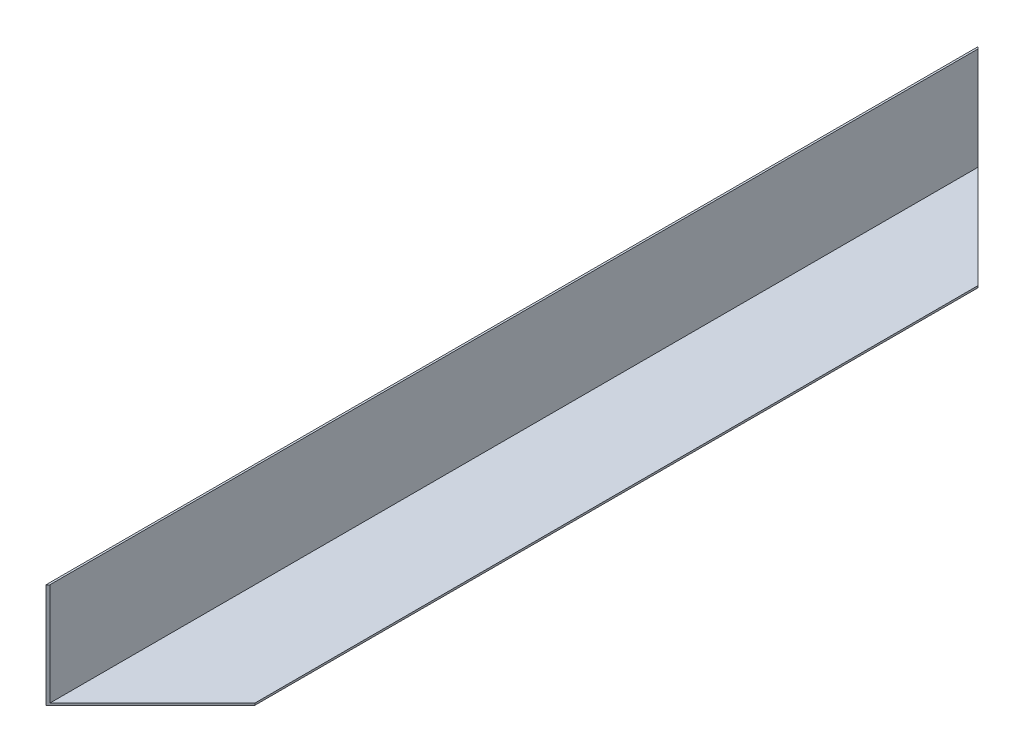
from build123d import *

# Parameters (mm, degrees)
BOSS_EXTRUDE1_DEPTH = 210


with BuildPart() as part:
    # Sketch1 → Boss-Extrude1 (new, symmetric)
    with BuildSketch(Plane.XY):
        Polygon((0, 45), (0, 0), (45, 0), (45, 0.833333333), (0.833333333, 0.833333333), (0.833333333, 45), align=None)
    extrude(amount=BOSS_EXTRUDE1_DEPTH, both=True)

    # SurfaceCut5
    split(bisect_by=Plane(origin=(100.416666667, 0, -100.416666667), x_dir=(0.7071067811865487, 0, 0.7071067811865465), z_dir=(-0.7071067811865465, 0, 0.7071067811865487)), keep=Keep.TOP)

    # SurfaceCut6
    split(bisect_by=Plane(origin=(100.416666667, 0, 100.416666667), x_dir=(0.7071067811865487, 0, -0.7071067811865465), z_dir=(0.7071067811865465, 0, 0.7071067811865487)), keep=Keep.BOTTOM)


solid = part.part
